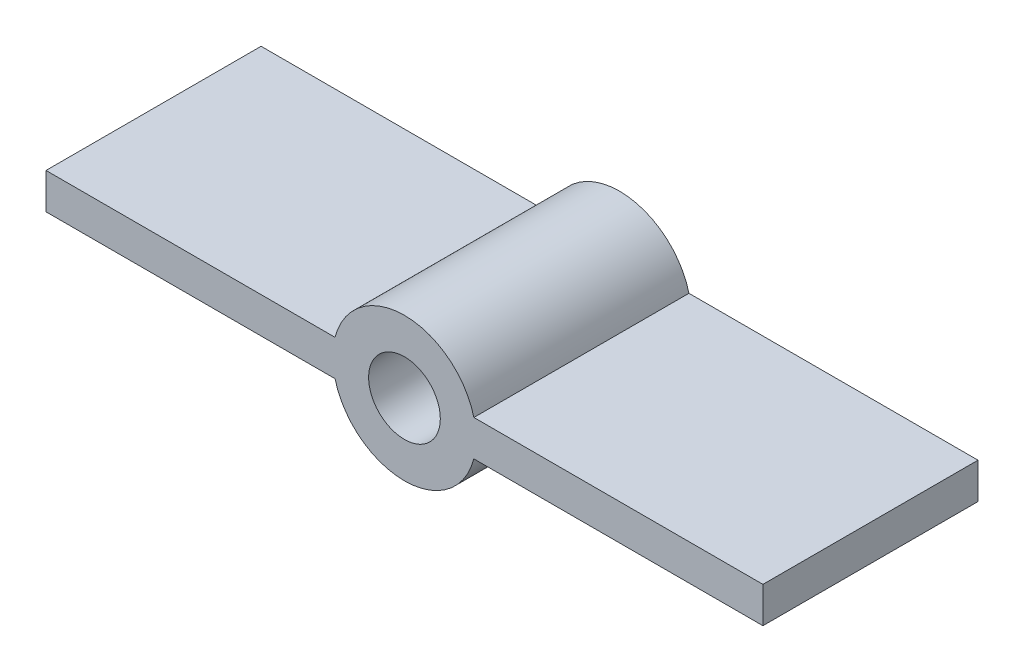
from build123d import *

# Parameters (mm, degrees)
SKETCH1_W           = 127
SKETCH1_H           = 38.1
BOSS_EXTRUDE1_DEPTH = 3.175
SKETCH3_R           = 12.7
BOSS_EXTRUDE2_DEPTH = 38.1
SKETCH4_R           = 6.35
CUT_EXTRUDE1_DEPTH  = 76.134213245


with BuildPart() as part:
    # Sketch1 → Boss-Extrude1 (new, symmetric)
    with BuildSketch(Plane(origin=(0, 0, 0), x_dir=(1, 0, 0), z_dir=(0, 1, 0))):
        Rectangle(SKETCH1_W, SKETCH1_H)
    extrude(amount=BOSS_EXTRUDE1_DEPTH, both=True)

    # Sketch3 → Boss-Extrude2 (add)
    with BuildSketch(Plane.XY.offset(19.05)):
        Circle(SKETCH3_R)
    extrude(amount=-BOSS_EXTRUDE2_DEPTH)

    # Sketch4 → Cut-Extrude1 (cut, through all)
    with BuildSketch(Plane.XY.offset(19.05)):
        Circle(SKETCH4_R)
    extrude(amount=-CUT_EXTRUDE1_DEPTH, mode=Mode.SUBTRACT)


solid = part.part
